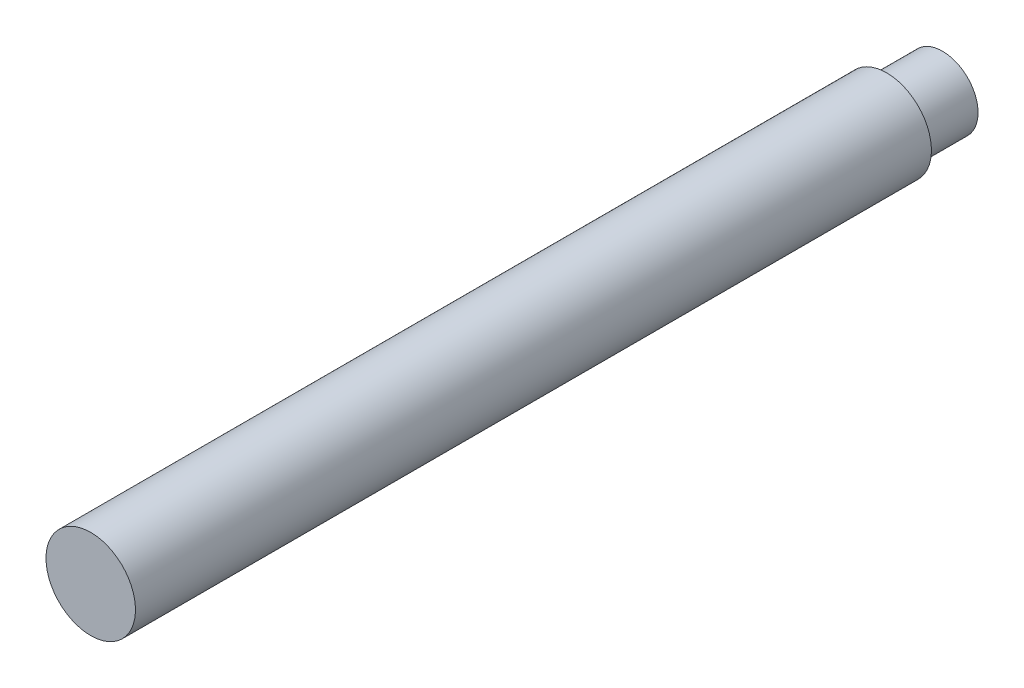
from build123d import *

# Parameters (mm, degrees)
SKETCH1_R           = 4.0005
BOSS_EXTRUDE1_DEPTH = 76.2
SKETCH2_R           = 6.466915926
SKETCH2_R_2         = 3.175
CUT_EXTRUDE1_DEPTH  = 5


with BuildPart() as part:
    # Sketch1 → Boss-Extrude1 (new body)
    with BuildSketch(Plane.XY):
        with Locations(Location((0, 0, 0), (0, 0, 180))):
            Circle(SKETCH1_R)
    extrude(amount=BOSS_EXTRUDE1_DEPTH)

    # Sketch2 → Cut-Extrude1 (cut)
    with BuildSketch(Plane(origin=(0, 0, 0), x_dir=(-1, 0, 0), z_dir=(0, 0, -1))):
        Circle(SKETCH2_R)
        Circle(SKETCH2_R_2, mode=Mode.SUBTRACT)
    extrude(amount=-CUT_EXTRUDE1_DEPTH, mode=Mode.SUBTRACT)


solid = part.part
